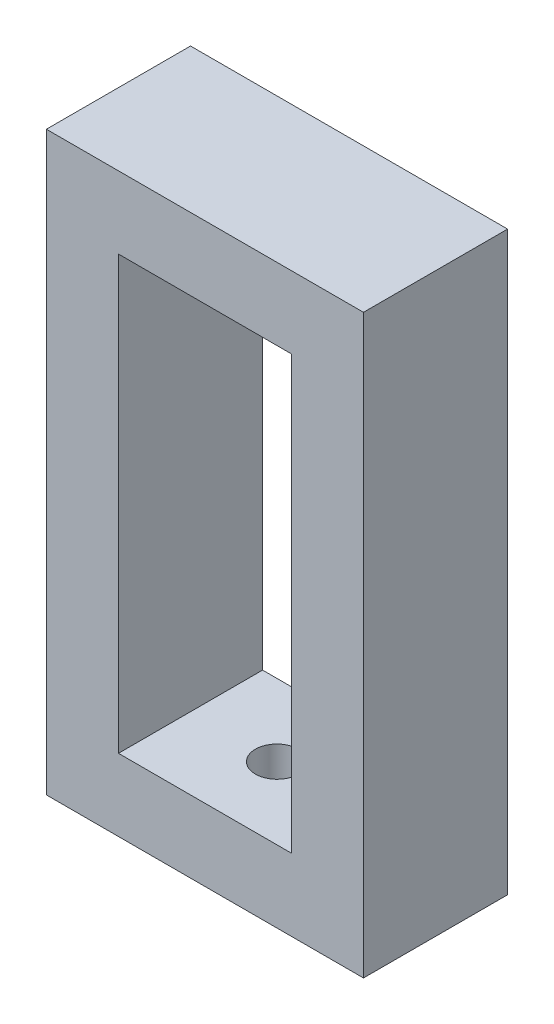
from build123d import *

# Parameters (mm, degrees)
SKETCH1_W           = 22
SKETCH1_H           = 40
SKETCH1_W_2         = 12
SKETCH1_H_2         = 30
BOSS_EXTRUDE1_DEPTH = 10
SKETCH2_R           = 1.5
CUT_EXTRUDE1_DEPTH  = 15


with BuildPart() as part:
    # Sketch1 → Boss-Extrude1 (new body)
    with BuildSketch(Plane.XY):
        with Locations((11, 20)):
            Rectangle(SKETCH1_W, SKETCH1_H)
        with Locations((11, 20)):
            Rectangle(SKETCH1_W_2, SKETCH1_H_2, mode=Mode.SUBTRACT)
    extrude(amount=BOSS_EXTRUDE1_DEPTH)

    # Sketch2 → Cut-Extrude1 (cut, symmetric)
    with BuildSketch(Plane(origin=(0, 0, 0), x_dir=(1, 0, 0), z_dir=(0, 1, 0))):
        with Locations(Location((11, -5, 0), (0, 0, 270))):
            Circle(SKETCH2_R)
    extrude(amount=CUT_EXTRUDE1_DEPTH, both=True, mode=Mode.SUBTRACT)


solid = part.part
